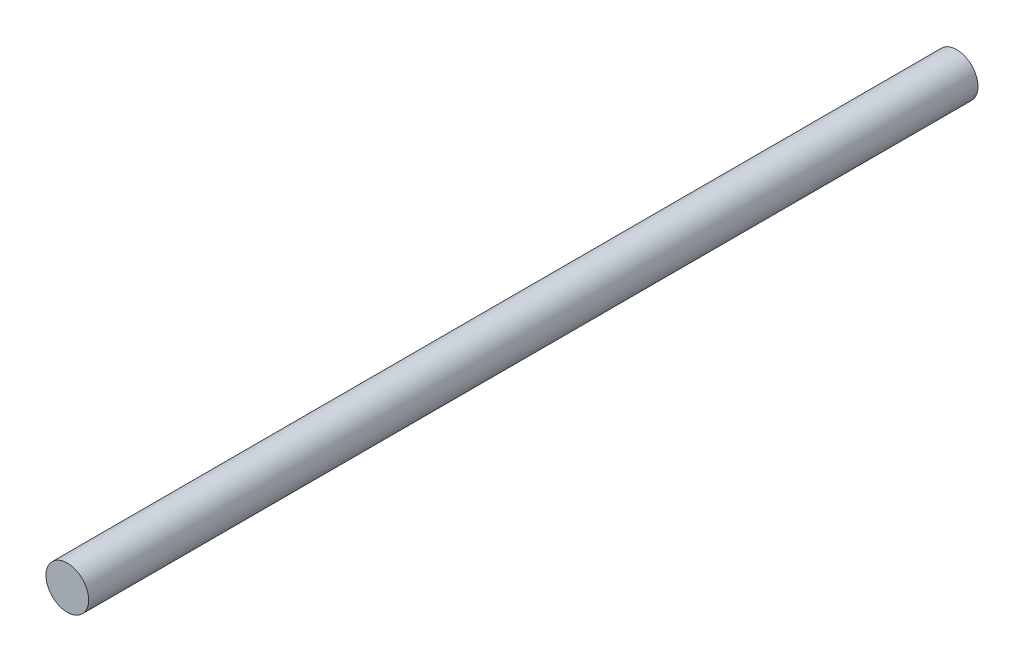
from build123d import *

# Parameters (mm, degrees)
SKETCH1_R           = 6
BOSS_EXTRUDE1_DEPTH = 250


with BuildPart() as part:
    # Sketch1 → Boss-Extrude1 (new body)
    with BuildSketch(Plane.XY):
        Circle(SKETCH1_R)
    extrude(amount=BOSS_EXTRUDE1_DEPTH)


solid = part.part
